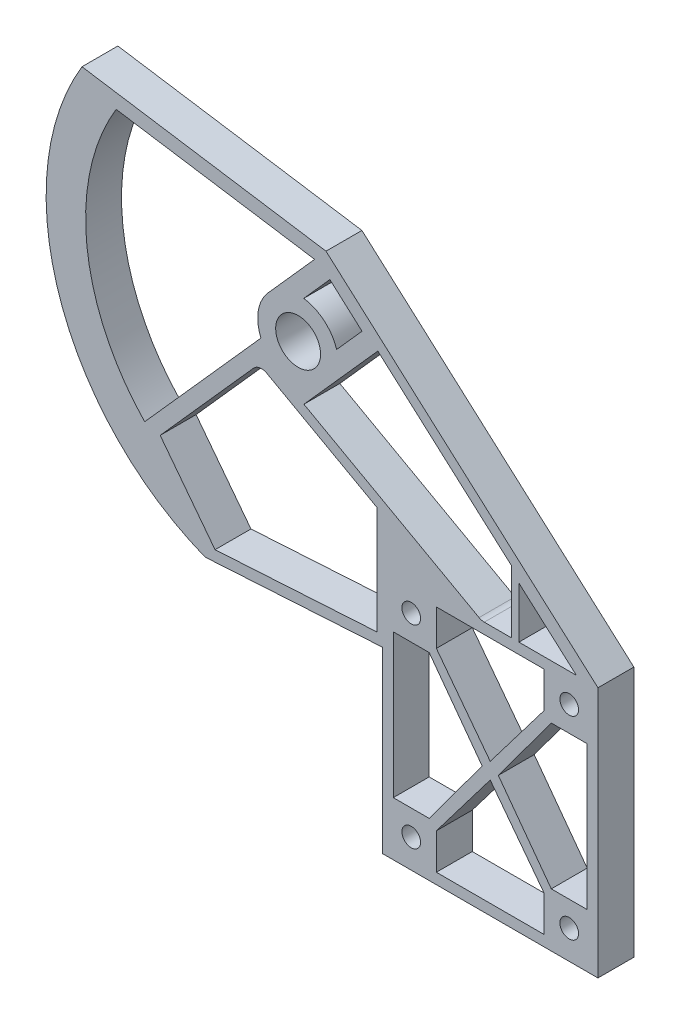
from build123d import *

# Parameters (mm, degrees)
BOSS_EXTRUDE1_DEPTH = 12.7
SKETCH2_R           = 7.9375
CUT_EXTRUDE1_DEPTH  = 25.4
CUT_EXTRUDE2_DEPTH  = 15.24
CUT_EXTRUDE4_DEPTH  = 12.7
CUT_EXTRUDE3_DEPTH  = 12.7
FILLET4_R           = 3.81
CUT_EXTRUDE8_REACH  = 306.459
SKETCH10_R          = 3.302
CUT_EXTRUDE11_DEPTH = 12.7
BOSS_EXTRUDE2_DEPTH = 12.7


with BuildPart() as part:
    # Sketch1 → Boss-Extrude1 (new body)
    with BuildSketch(Plane.XY):
        with BuildLine():
            Line((22.605250022, 67.052290313), (98.805250022, 67.052290313))
            Line((98.805250022, 67.052290313), (98.805250022, 155.952290313))
            Line((98.805250022, 155.952290313), (-49.161223166, 287.699993186))
            ThreePointArc((-49.161223166, 287.699993186), (-96.236474745, 204.218681994), (-40.152034083, 126.502891159))
            Line((-40.152034083, 126.502891159), (22.605250022, 130.274128502))
            Line((22.605250022, 130.274128502), (22.605250022, 67.052290313))
        make_face()
    extrude(amount=BOSS_EXTRUDE1_DEPTH)

    # Sketch2 → Cut-Extrude1 (cut)
    with BuildSketch(Plane.XY.offset(12.7)):
        with Locations((-7.239749978, 209.038290313)):
            Circle(SKETCH2_R)
    extrude(amount=-CUT_EXTRUDE1_DEPTH, mode=Mode.SUBTRACT)

    # Sketch3 → Cut-Extrude2 (cut)
    with BuildSketch(Plane.XY.offset(12.7)):
        Polygon((41.655250022, 70.862290313), (41.655250022, 83.562290313), (60.705250022, 108.644790313), (79.755250022, 83.562290313), (79.755250022, 70.862290313), align=None)
        Polygon((26.415250022, 86.102290313), (39.115250022, 86.102290313), (57.847750022, 111.502290313), (39.115250022, 136.902290313), (26.415250022, 136.902290313), align=None)
        Polygon((94.995250022, 86.102290313), (82.295250022, 86.102290313), (63.562750022, 111.502290313), (82.295250022, 136.902290313), (94.995250022, 136.902290313), align=None)
        Polygon((41.655250022, 152.142290313), (41.655250022, 139.442290313), (60.705250022, 114.359790313), (79.755250022, 139.442290313), (79.755250022, 152.142290313), align=None)
    extrude(amount=-CUT_EXTRUDE2_DEPTH, mode=Mode.SUBTRACT)

    # Sketch5 → Cut-Extrude4 (cut)
    with BuildSketch(Plane.XY.offset(12.7)):
        with BuildLine():
            Line((-17.910409102, 218.539326578), (-0.75941726, 237.80168728))
            Line((-0.75941726, 237.80168728), (-42.818220106, 275.250377791))
            ThreePointArc((-42.818220106, 275.250377791), (-81.480920705, 220.910985735), (-61.519248594, 157.278402939))
            Line((-61.519248594, 157.278402939), (-20.395339746, 203.464861019))
            ThreePointArc((-20.395339746, 203.464861019), (-21.336998363, 211.362132865), (-17.910409102, 218.539326578))
        make_face()
        Polygon((-56.03788631, 155.851799386), (-36.620175939, 130.532002023), (20.700250022, 133.976525379), (20.700250022, 172.076525379), (-20.994230128, 195.20949671), align=None)
        with BuildLine():
            Line((3.983097906, 233.579004496), (-5.26797782, 223.189077245))
            ThreePointArc((-5.26797782, 223.189077245), (1.977645927, 219.954895508), (6.380422315, 213.353792944))
            Line((6.380422315, 213.353792944), (15.365134305, 223.444565813))
            Line((15.365134305, 223.444565813), (3.983097906, 233.579004496))
        make_face()
    extrude(amount=-CUT_EXTRUDE4_DEPTH, mode=Mode.SUBTRACT)

    # Sketch4 → Cut-Extrude3 (cut)
    with BuildSketch(Plane.XY.offset(12.7)):
        Polygon((57.615510223, 155.952290313), (-5.197073481, 190.802028044), (20.952186028, 220.170386062), (68.306030681, 178.007049188), (68.306030681, 155.952290313), align=None)
        Polygon((91.166030681, 155.952290313), (70.846030681, 155.952290313), (70.846030681, 174.044992428), align=None)
    extrude(amount=-CUT_EXTRUDE3_DEPTH, mode=Mode.SUBTRACT)

    # Fillet4
    fillet4_edges = [part.edges().sort_by_distance(p)[0] for p in [
        (-20.994230128, 195.20949671, 6.35),
        (57.615510223, 155.952290313, 6.35),
    ]]
    fillet(fillet4_edges, radius=FILLET4_R)

    # Sketch10 → Cut-Extrude8 (cut, up to next)
    with BuildSketch(Plane.XY.offset(12.7), mode=Mode.PRIVATE) as cut_extrude8_sk1:
        with Locations((32.765250022, 77.212290313)):
            Circle(SKETCH10_R)
    cut_extrude8_tool1 = extrude(cut_extrude8_sk1.sketch, amount=-CUT_EXTRUDE8_REACH, mode=Mode.PRIVATE) & part.part
    # Sketch10 → Cut-Extrude8 (cut, up to next)
    with BuildSketch(Plane.XY.offset(12.7), mode=Mode.PRIVATE) as cut_extrude8_sk2:
        with Locations((32.765250022, 145.792290313)):
            Circle(SKETCH10_R)
    cut_extrude8_tool2 = extrude(cut_extrude8_sk2.sketch, amount=-CUT_EXTRUDE8_REACH, mode=Mode.PRIVATE) & part.part
    # Sketch10 → Cut-Extrude8 (cut, up to next)
    with BuildSketch(Plane.XY.offset(12.7), mode=Mode.PRIVATE) as cut_extrude8_sk3:
        with Locations((88.645250022, 145.792290313)):
            Circle(SKETCH10_R)
    cut_extrude8_tool3 = extrude(cut_extrude8_sk3.sketch, amount=-CUT_EXTRUDE8_REACH, mode=Mode.PRIVATE) & part.part
    # Sketch10 → Cut-Extrude8 (cut, up to next)
    with BuildSketch(Plane.XY.offset(12.7), mode=Mode.PRIVATE) as cut_extrude8_sk4:
        with Locations((88.645250022, 77.212290313)):
            Circle(SKETCH10_R)
    cut_extrude8_tool4 = extrude(cut_extrude8_sk4.sketch, amount=-CUT_EXTRUDE8_REACH, mode=Mode.PRIVATE) & part.part
    add(cut_extrude8_tool1.solids().sort_by_distance((32.76525, 77.21229, 12.7))[0], mode=Mode.SUBTRACT)
    add(cut_extrude8_tool2.solids().sort_by_distance((32.76525, 145.79229, 12.7))[0], mode=Mode.SUBTRACT)
    add(cut_extrude8_tool3.solids().sort_by_distance((88.64525, 145.79229, 12.7))[0], mode=Mode.SUBTRACT)
    add(cut_extrude8_tool4.solids().sort_by_distance((88.64525, 77.21229, 12.7))[0], mode=Mode.SUBTRACT)

    # Sketch14 → Cut-Extrude11 (cut)
    with BuildSketch(Plane.XY.offset(12.7)):
        Polygon((-0.75941726, 237.80168728), (-90.284904, 256.297301642), (-56.503441725, 294.237422972), (2.618728967, 241.595699413), align=None)
    extrude(amount=-CUT_EXTRUDE11_DEPTH, mode=Mode.SUBTRACT)

    # Sketch15 → Boss-Extrude2 (add)
    with BuildSketch(Plane.XY.offset(12.7)):
        Polygon((2.618728967, 241.595699413), (-83.695447283, 254.935945734), (-84.471371658, 249.915553183), (-1.404499457, 237.07719239), align=None)
    extrude(amount=-BOSS_EXTRUDE2_DEPTH)


solid = part.part
